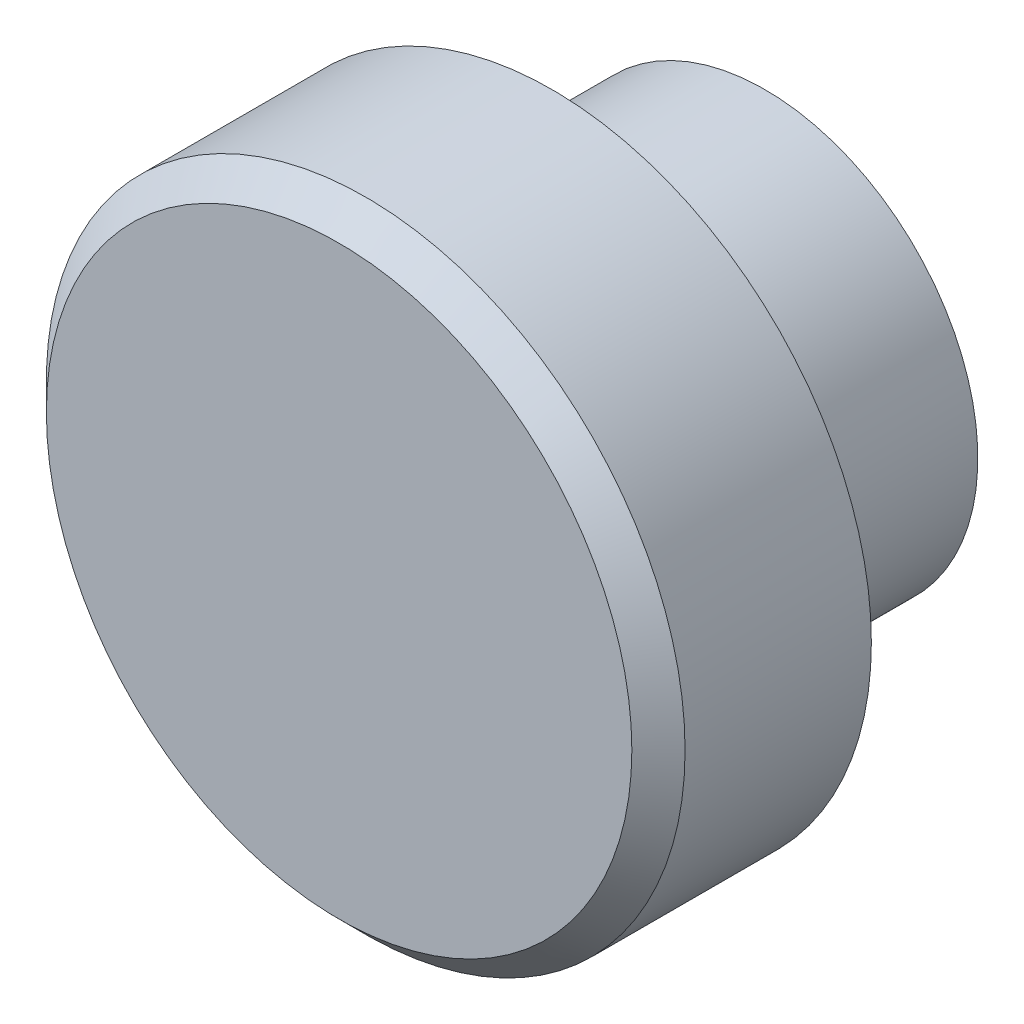
from build123d import *

# Parameters (mm, degrees)
SKETCH1_R           = 12
BOSS_EXTRUDE1_DEPTH = 8
CHAMFER1_SIZE       = 1
SKETCH2_R           = 8
BOSS_EXTRUDE2_DEPTH = 8


with BuildPart() as part:
    # Sketch1 → Boss-Extrude1 (new body)
    with BuildSketch(Plane.XY):
        Circle(SKETCH1_R)
    extrude(amount=BOSS_EXTRUDE1_DEPTH)

    # Chamfer1
    chamfer1_edges = [part.edges().sort_by_distance(p)[0] for p in [
        (-12, 0, 8),
    ]]
    chamfer(chamfer1_edges, length=CHAMFER1_SIZE)

    # Sketch2 → Boss-Extrude2 (add)
    with BuildSketch(Plane(origin=(0, 0, 0), x_dir=(-1, 0, 0), z_dir=(0, 0, -1))):
        Circle(SKETCH2_R)
    extrude(amount=BOSS_EXTRUDE2_DEPTH)


solid = part.part
